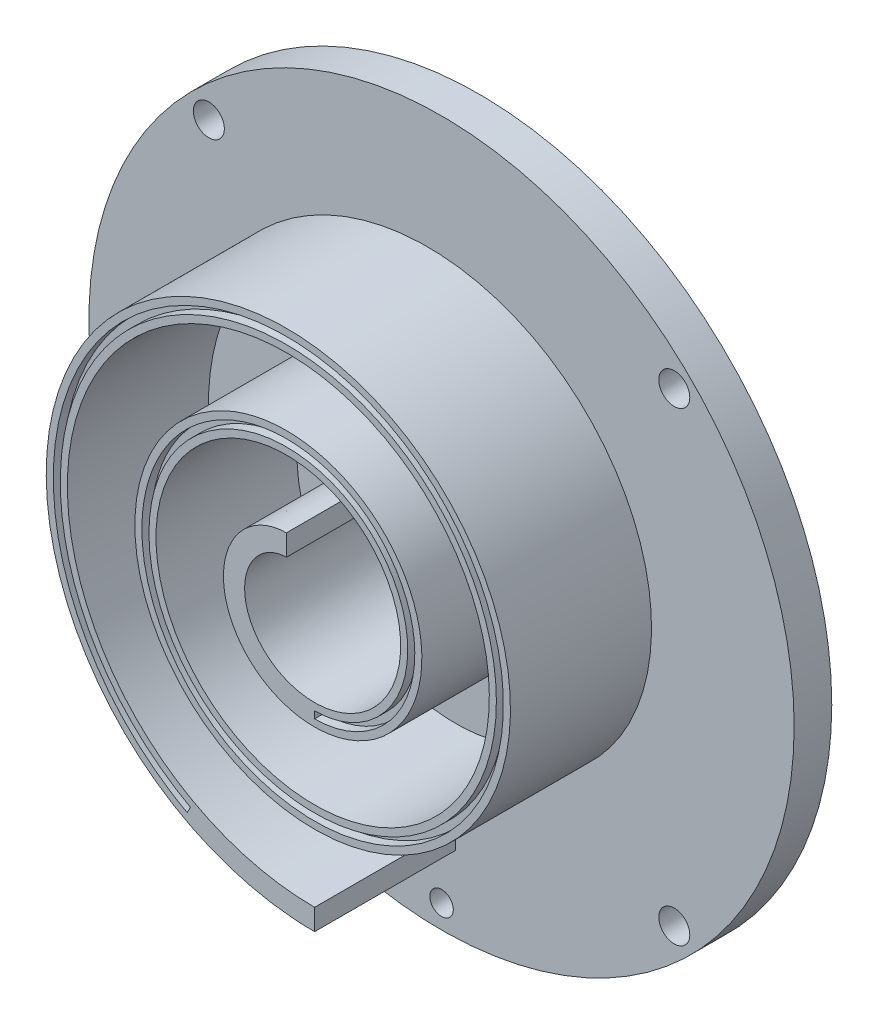
from build123d import *

# Parameters (mm, degrees)
SKETCH_1_R          = 75
EXTRUDE_1_DEPTH     = 8
SKETCH_2_R          = 5
CUT_EXTRUDE_1_DEPTH = 107.367288205
EXTRUDE_2_DEPTH     = 30
SKETCH_4_R          = 3.3
CUT_EXTRUDE_2_DEPTH = 113.667653023
SKETCH_5_R          = 2.5
CUT_EXTRUDE_3_DEPTH = 113.667653023
CUT_EXTRUDE_4_DEPTH = 2


with BuildPart() as part:
    # 草图1 → 凸台-拉伸1 (new body)
    with BuildSketch(Plane.XY):
        Circle(SKETCH_1_R)
    extrude(amount=EXTRUDE_1_DEPTH)

    # 草图2 → 切除-拉伸1 (cut, through all)
    with BuildSketch(Plane.XY):
        Circle(SKETCH_2_R)
    extrude(amount=CUT_EXTRUDE_1_DEPTH, mode=Mode.SUBTRACT)

    # 草图3 → 凸台-拉伸2 (add)
    with BuildSketch(Plane.XY.offset(8)):
        with BuildLine():
            Line((3, -58.798668), (3, -54.298667765))
            add(Edge.make_bspline(
                [(3, -54.298667765), (2.445183278, -54.293758638), (1.336490844, -54.283948711), (-0.323572997, -54.20463871), (-1.977695596, -54.078311219), (-3.624333548, -53.900631454), (-5.2619549, -53.673172227), (-6.889043171, -53.395994134), (-8.504095073, -53.069611611), (-10.105625706, -52.694480691), (-11.692167513, -52.271129694), (-13.262271405, -51.800121469), (-14.814509907, -51.282067121), (-16.347475934, -50.717616715), (-17.859788123, -50.107466936), (-19.35008608, -49.452348857), (-20.817038807, -48.753041677), (-22.259338754, -48.010356605), (-23.675708608, -47.225148391), (-25.064898965, -46.398306871), (-26.425691432, -45.530759998), (-27.756897794, -44.623469581), (-29.057364146, -43.6774343), (-30.325965261, -42.693680551), (-31.56161752, -41.673276324), (-32.763265731, -40.61731228), (-33.929893215, -39.526912999), (-35.060521123, -38.403231348), (-36.154207837, -37.247448932), (-37.21004835, -36.060770567), (-38.227180326, -34.8444303), (-39.204777482, -33.599682159), (-40.142057292, -32.32780602), (-41.038277016, -31.030101679), (-41.892734754, -29.707887987), (-42.704773949, -28.362504736), (-43.473775679, -26.995306132), (-44.199170013, -25.607665331), (-44.880423719, -24.200966668), (-45.517057999, -22.77661233), (-46.108625154, -21.336010744), (-46.654733975, -19.880585787), (-47.155028755, -18.4117668), (-47.609205072, -16.930992791), (-48.016999541, -15.439707836), (-48.378197745, -13.939361248), (-48.692626027, -12.431405523), (-48.960158046, -10.917295118), (-49.180713938, -9.398485926), (-49.354257622, -7.876431897), (-49.480797162, -6.35258497), (-49.560384365, -4.828393469), (-49.593121553, -3.305301243), (-49.579147361, -1.784745507), (-49.518650824, -0.268155917), (-49.411858827, 1.243047016), (-49.259048621, 2.747453568), (-49.060533927, 4.243665292), (-48.816672447, 5.730296622), (-48.527867651, 7.205976755), (-48.194559563, 8.669349796), (-47.817229762, 10.119076751), (-47.396404451, 11.553837704), (-46.932641498, 12.972329951), (-46.426546809, 14.373273317), (-45.87875411, 15.755406704), (-45.289945734, 17.117495213), (-44.660830818, 18.45832406), (-43.992161311, 19.776706044), (-43.284717282, 21.071476361), (-42.539321406, 22.341502933), (-41.756819395, 23.585674703), (-40.93809911, 24.802916508), (-40.084072254, 25.992176985), (-39.195683004, 27.152438149), (-38.273905538, 28.282713183), (-37.319743073, 29.382048876), (-36.334223851, 30.449524078), (-35.318400653, 31.484249649), (-34.27335608, 32.485376187), (-33.200192334, 33.452085183), (-32.10003409, 34.383593336), (-30.97403128, 35.279159937), (-29.823349611, 36.138075103), (-28.64917543, 36.959669425), (-27.452715201, 37.743313627), (-26.23518816, 38.488412957), (-24.997831328, 39.194414871), (-23.741895494, 39.860807002), (-22.468641569, 40.487110071), (-21.179348043, 41.072896752), (-19.875297337, 41.617768775), (-18.55778416, 42.121373358), (-17.228111238, 42.583402637), (-15.887585272, 43.003579155), (-14.537521779, 43.381679167), (-13.179236458, 43.717508688), (-11.814049999, 44.010921774), (-10.443283157, 44.261811249), (-9.068257711, 44.470112271), (-7.690293499, 44.635799608), (-6.310708499, 44.758889069), (-4.930816396, 44.839438718), (-3.551925689, 44.877542296), (-2.175338744, 44.873342066), (-0.802350879, 44.827009275), (0.565751434, 44.738766404), (1.927691793, 44.60886611), (3.282204702, 44.437604682), (4.628037612, 44.225314725), (5.963950119, 43.972366277), (7.288717707, 43.679168099), (8.601130696, 43.346166188), (9.899996556, 42.973840543), (11.18414051, 42.562708643), (12.452407252, 42.113323004), (13.703660309, 41.626268698), (14.936786193, 41.102168297), (16.150689817, 40.541670298), (17.34430286, 39.945462288), (18.516579812, 39.314261523), (19.666498233, 38.64881137), (20.793063612, 37.94988975), (21.89530756, 37.218302636), (22.972286427, 36.454880345), (24.023088326, 35.660485368), (25.046827897, 34.836001912), (26.04265161, 33.982342384), (27.009734166, 33.100439371), (27.947279505, 32.191254668), (28.854538112, 31.255757518), (30.021469267, 29.976204711), (31.401305324, 28.315991692), (32.92665999, 26.232979043), (34.315340086, 24.069821918), (35.563243292, 21.835457772), (36.666891884, 19.538958227), (37.623380812, 17.189571216), (38.430393872, 14.79666044), (39.086203787, 12.369674984), (39.589685854, 9.918112123), (39.940296526, 7.451476554), (40.138091475, 4.979247168), (40.183709482, 2.510839817), (40.078358865, 0.055570125), (39.823826121, -2.377379994), (39.422447135, -4.778998559), (38.87709439, -7.140473606), (38.191177901, -9.453230468), (37.368601652, -11.708956971), (36.41376769, -13.899639521), (35.331539091, -16.017586107), (34.127222375, -18.055455658), (32.806545293, -20.006284226), (31.375622653, -21.863504428), (29.840940968, -23.620973859), (28.209319854, -25.272989587), (26.487884915, -26.814306106), (24.684041302, -28.240156286), (22.805436263, -29.54625956), (20.859932367, -30.728838736), (18.855571379, -31.784627534), (16.800543203, -32.710877893), (14.70315084, -33.505366043), (12.571780743, -34.166399853), (10.414864801, -34.692814867), (8.240849409, -35.083973092), (6.058162794, -35.33977116), (3.87518086, -35.460617293), (1.700196679, -35.447446289), (-0.45861227, -35.301688921), (-2.593213948, -35.025277509), (-4.695752936, -34.620630143), (-6.758576554, -34.0906243), (-8.774267417, -33.438604168), (-10.735664229, -32.668337037), (-12.635891754, -31.784013964), (-14.468383604, -30.79022021), (-16.226902532, -29.691913167), (-17.905564619, -28.494403223), (-19.498856017, -27.20332483), (-21.001652762, -25.82461414), (-22.409235722, -24.364481066), (-23.717306006, -22.829384483), (-24.921994535, -21.226000098), (-26.01987308, -19.561193711), (-27.007970669, -17.841996707), (-27.883764939, -16.075566954), (-28.645206123, -14.269171491), (-29.290703255, -12.430145866), (-29.819133589, -10.565870776), (-30.229843248, -8.683741271), (-30.522638774, -6.791136097), (-30.697789924, -4.895390601), (-30.756015729, -3.003766979), (-30.698483087, -1.123427528), (-30.526793603, 0.738592998), (-30.242972224, 2.575413816), (-29.849459644, 4.380333335), (-29.349088781, 6.146853688), (-28.74507585, 7.868703095), (-28.041003537, 9.539860959), (-27.240797966, 11.154574699), (-26.348713877, 12.707383476), (-25.369308462, 14.193131925), (-24.307427185, 15.606992451), (-23.16817219, 16.944473907), (-21.95688853, 18.201442907), (-20.679131983, 19.374129041), (-19.340650399, 20.459142162), (-17.947351004, 21.453471468), (-16.505285083, 22.354505629), (-15.020613755, 23.16002732), (-13.499586276, 23.86822366), (-11.948511601, 24.477683816), (-10.373735042, 24.987407232), (-8.781609287, 25.39679005), (-7.178472767, 25.705638045), (-5.570620873, 25.914144345), (-3.964283666, 26.022904804), (-2.36560024, 26.032886867), (-0.780595761, 25.945442886), (0.784839878, 25.762282124), (2.324976688, 25.485474282), (3.834263005, 25.117424145), (5.307345837, 24.660860059), (6.739093184, 24.118830258), (8.12460437, 23.494663936), (9.459236886, 22.791980051), (10.738610938, 22.014644858), (11.958632628, 21.166770695), (13.115500084, 20.252686194), (14.20571995, 19.276920125), (15.226110449, 18.244175188), (16.173820378, 17.159314988), (17.046323828, 16.027332195), (17.841436553, 14.853334638), (18.557311555, 13.642517132), (19.192449195, 12.400142536), (19.745692941, 11.131517965), (20.216229519, 9.841971023), (20.603591346, 8.536831196), (20.907648523, 7.221404156), (21.128607196, 5.900952868), (21.267001636, 4.580675874), (21.323690548, 3.265687108), (21.299845327, 1.960994899), (21.196939637, 0.671484529), (21.016744092, -0.598101303), (20.761308049, -1.843178439), (20.432950226, -3.059339656), (20.034245916, -4.242369538), (19.568007081, -5.388257985), (19.037273777, -6.493214762), (18.445290926, -7.553680634), (17.795497522, -8.566339894), (17.091506136, -9.528130707), (16.337083884, -10.436250867), (15.536136195, -11.288168675), (14.69268787, -12.081627149), (13.810861877, -12.814649062), (12.894864117, -13.485541947), (11.94895942, -14.092898112), (10.977458287, -14.635599573), (9.984690869, -15.112810397), (8.974996248, -15.523988191), (7.952695067, -15.868863875), (6.922079524, -16.147458162), (5.887388915, -16.360054746), (4.852796911, -16.507216035), (3.822391984, -16.589756649), (2.800162761, -16.608748939), (1.78998237, -16.565507549), (0.795593681, -16.461577763), (-0.179405327, -16.298731827), (-1.1315734, -16.078947307), (-2.057638908, -15.804402963), (-2.95451031, -15.477460279), (-3.819286562, -15.10065191), (-4.649267055, -14.676666449), (-5.441958956, -14.208334594), (-6.195082957, -13.698609963), (-6.906582995, -13.150561314), (-7.574624745, -12.567345872), (-8.197607822, -11.952205372), (-8.774160424, -11.308439813), (-9.303144483, -10.639396486), (-9.783658558, -9.948454271), (-10.215027793, -9.239001944), (-10.596818196, -8.514432691), (-10.928814418, -7.778117065), (-11.211032545, -7.033396504), (-11.443706443, -6.283564764), (-11.627285208, -5.531854905), (-11.762421449, -4.781424236), (-11.849972076, -4.035342542), (-11.890983973, -3.296579139), (-11.886687086, -2.567991075), (-11.838481464, -1.852312321), (-11.747934724, -1.152142345), (-11.616758854, -0.469938904), (-11.44680876, 0.191992274), (-11.240068093, 0.831504433), (-10.998632776, 1.446619948), (-10.724703638, 2.035521357), (-10.420550009, 2.596605844), (-9.982059301, 3.299010947), (-9.372088363, 4.102648195), (-8.551579671, 4.945499353), (-7.669354304, 5.653415759), (-6.745661706, 6.224044334), (-5.800195882, 6.659194275), (-4.851790838, 6.95912256), (-3.918074998, 7.141273419), (-3.301005261, 7.163792999), (-3, 7.174778)],
                knots=[0, 0, 0, 0, 0.003447685, 0.006889523, 0.010325511, 0.013755651, 0.017179942, 0.020598382, 0.024010975, 0.027417717, 0.030818612, 0.034213659, 0.037602855, 0.040986203, 0.044363701, 0.047735352, 0.051101152, 0.054461103, 0.057815207, 0.061163461, 0.064505865, 0.067842422, 0.071173128, 0.074497986, 0.077816996, 0.081130156, 0.084437468, 0.087738929, 0.091034544, 0.094324307, 0.097608222, 0.10088629, 0.104158507, 0.107424875, 0.110685395, 0.113940066, 0.117188888, 0.12043186, 0.123668984, 0.126900259, 0.130125686, 0.133345263, 0.136558991, 0.13976687, 0.1429689, 0.14616508, 0.149355414, 0.152539897, 0.155718531, 0.158891316, 0.162058252, 0.165219339, 0.168374579, 0.171523969, 0.174667509, 0.177805201, 0.180937043, 0.184063037, 0.187183182, 0.190297479, 0.193405925, 0.196508523, 0.199605273, 0.202696172, 0.205781224, 0.208860425, 0.211933778, 0.215001284, 0.218062939, 0.221118745, 0.224168701, 0.22721281, 0.230251069, 0.233283481, 0.236310042, 0.239330755, 0.242345619, 0.245354632, 0.248357799, 0.251355117, 0.254346584, 0.257332204, 0.260311973, 0.263285894, 0.266253967, 0.269216191, 0.272172563, 0.275123089, 0.278067765, 0.281006593, 0.283939572, 0.2868667, 0.289787982, 0.292703413, 0.295612996, 0.29851673, 0.301414614, 0.30430665, 0.307192837, 0.310073175, 0.312947665, 0.315816305, 0.318679094, 0.321536036, 0.324387129, 0.327232374, 0.33007177, 0.332905315, 0.335733013, 0.338554861, 0.341370862, 0.344181011, 0.346985313, 0.349783765, 0.352576369, 0.355363124, 0.35814403, 0.360919086, 0.363688295, 0.366451653, 0.369209162, 0.371960823, 0.374706635, 0.377446599, 0.380180714, 0.382908979, 0.385631394, 0.388347962, 0.391058681, 0.393763549, 0.396462569, 0.399155742, 0.404523905, 0.409868677, 0.415190057, 0.420488042, 0.425762633, 0.431013832, 0.436241639, 0.441446052, 0.446627072, 0.451784699, 0.456918932, 0.462029775, 0.467117222, 0.472181277, 0.477221939, 0.482239208, 0.487233084, 0.492203566, 0.497150655, 0.502074352, 0.506974654, 0.511851565, 0.516705082, 0.521535207, 0.526341938, 0.531125277, 0.535885222, 0.540621773, 0.545334933, 0.550024698, 0.554691071, 0.559334051, 0.563953639, 0.568549833, 0.573122633, 0.577672041, 0.582198056, 0.586700677, 0.591179906, 0.595635741, 0.600068183, 0.604477232, 0.608862889, 0.613225152, 0.617564022, 0.621879499, 0.626171585, 0.630440276, 0.634685574, 0.638907478, 0.643105991, 0.647281111, 0.651432836, 0.655561168, 0.659666108, 0.663747654, 0.667805809, 0.67184057, 0.675851938, 0.679839913, 0.683804493, 0.687745681, 0.691663477, 0.695557879, 0.699428888, 0.703276505, 0.707100729, 0.710901558, 0.714678996, 0.718433039, 0.722163691, 0.725870949, 0.729554814, 0.733215286, 0.736852365, 0.74046605, 0.744056343, 0.747623242, 0.751166748, 0.754686863, 0.758183583, 0.76165691, 0.765106845, 0.768533385, 0.771936534, 0.77531629, 0.778672652, 0.782005621, 0.785315198, 0.788601379, 0.791864171, 0.795103567, 0.798319571, 0.801512182, 0.8046814, 0.807827225, 0.810949656, 0.814048695, 0.81712434, 0.820176594, 0.823205452, 0.826210919, 0.829192992, 0.832151673, 0.83508696, 0.837998855, 0.840887355, 0.843752465, 0.846594179, 0.8494125, 0.852207429, 0.854978966, 0.857727109, 0.860451859, 0.863153215, 0.86583118, 0.868485751, 0.871116928, 0.873724712, 0.876309103, 0.878870102, 0.881407708, 0.88392192, 0.88641274, 0.888880166, 0.8913242, 0.893744839, 0.896142088, 0.89851594, 0.900866402, 0.903193469, 0.905497146, 0.907777427, 0.910034316, 0.912267812, 0.914477914, 0.916664624, 0.91882794, 0.920967864, 0.923084395, 0.925177533, 0.927247278, 0.929293628, 0.931316587, 0.933316153, 0.935292325, 0.937245105, 0.93917449, 0.941080484, 0.942963083, 0.94482229, 0.946658104, 0.948470525, 0.950259554, 0.952025189, 0.95376743, 0.955486279, 0.957181735, 0.958853797, 0.960502466, 0.962127744, 0.963729628, 0.965308117, 0.966863214, 0.96839492, 0.96990323, 0.971388148, 0.972849674, 0.974287807, 0.975702546, 0.977093892, 0.978461845, 0.979806405, 0.981127572, 0.982425346, 0.984949526, 0.987380178, 0.989717301, 0.991960897, 0.994110966, 0.996167504, 0.998130517, 1, 1, 1, 1], degree=3))
            Line((-3, 7.174778), (-3, 11.674777961))
            add(Edge.make_bspline(
                [(-3, 11.674777961), (-3.240666522, 11.670474975), (-3.725764482, 11.661801689), (-4.456285569, 11.591617542), (-5.192454744, 11.47832924), (-5.931288534, 11.316801958), (-6.66971111, 11.107439414), (-7.404566095, 10.849383043), (-8.132626479, 10.542376743), (-8.850617017, 10.186282877), (-9.555216939, 9.781200262), (-10.243086097, 9.327454779), (-10.910870697, 8.825594305), (-11.555225656, 8.276400839), (-12.17282846, 7.680887402), (-12.7603904, 7.040295157), (-13.314681323, 6.356101036), (-13.832536613, 5.630005617), (-14.310879344, 4.863937858), (-14.746733125, 4.060045726), (-15.137241754, 3.220695732), (-15.479676845, 2.348460582), (-15.771460163, 1.446117229), (-16.010173617, 0.516635118), (-16.193579527, -0.436831771), (-16.319625286, -1.410957617), (-16.386460736, -2.402254334), (-16.392453095, -3.407083677), (-16.336193495, -4.421672648), (-16.216509686, -5.44212543), (-16.032476379, -6.464441064), (-15.783422718, -7.484525975), (-15.468936208, -8.498211471), (-15.088882335, -9.50127333), (-14.643391519, -10.489444361), (-14.132878167, -11.458436594), (-13.558036793, -12.403956519), (-12.919847667, -13.321726192), (-12.219575001, -14.207500612), (-11.458765357, -15.05708494), (-10.63925231, -15.866360066), (-9.763144237, -16.631291327), (-8.832827542, -17.347956481), (-7.850959133, -18.012561923), (-6.820456374, -18.621457434), (-5.744491917, -19.171157298), (-4.626486414, -19.658361336), (-3.470092151, -20.079961959), (-2.279188438, -20.433072508), (-1.057862934, -20.715036668), (0.189600415, -20.923438745), (1.458734255, -21.056131551), (2.744906157, -21.11123461), (4.043334928, -21.087156765), (5.349108192, -20.982604585), (6.657200489, -20.796587306), (7.96249331, -20.528434592), (9.259796401, -20.177799897), (10.543864031, -19.744660202), (11.809421796, -19.229337331), (13.051182905, -18.632484569), (14.263873893, -17.955100037), (15.442255081, -17.198523185), (16.581141718, -16.364434898), (17.675429934, -15.454857106), (18.7201148, -14.472147283), (19.710313856, -13.418992936), (20.641291878, -12.298410489), (21.508478982, -11.113731206), (22.307491468, -9.868594479), (23.034159049, -8.566939723), (23.684533868, -7.212988841), (24.254918029, -5.811237353), (24.74188588, -4.366440801), (25.142285914, -2.88359209), (25.45327733, -1.367912474), (25.672329098, 0.175173238), (25.797246812, 1.740051611), (25.826175779, 3.320943723), (25.757625769, 4.911924322), (25.590468117, 6.506946135), (25.323953104, 8.099861382), (24.957716374, 9.684446165), (24.491788992, 11.254425227), (23.926592515, 12.803494273), (23.262954888, 14.325348693), (22.502100966, 15.813705775), (21.645664146, 17.262335169), (20.695669773, 18.665076687), (19.654551091, 20.015877143), (18.525124093, 21.308802269), (17.310600487, 22.538078308), (16.014560826, 23.698100366), (14.640962337, 24.78347337), (13.1941142, 25.789023863), (11.678670993, 26.709828568), (10.099616357, 27.541237515), (8.462249293, 28.278897798), (6.772160724, 28.918764204), (5.0352234, 29.457138411), (3.257562572, 29.890665363), (1.445541614, 30.216372013), (-0.394265823, 30.431662495), (-2.255095363, 30.534355047), (-4.130020347, 30.522676756), (-6.011975311, 30.395288577), (-7.893783424, 30.151281828), (-9.768184142, 29.790207036), (-11.627859738, 29.312056129), (-13.465467655, 28.717293091), (-15.273662923, 28.006831477), (-17.04513463, 27.182059333), (-18.77263055, 26.244824331), (-20.448986113, 25.197433113), (-22.067159868, 24.042655656), (-23.620254973, 22.783708332), (-25.101554324, 21.424253354), (-26.50454521, 19.968386091), (-27.822948958, 18.420624106), (-29.050750458, 16.785895463), (-30.182217345, 15.069518493), (-31.211935122, 13.277191246), (-32.13482769, 11.414969863), (-32.946179176, 9.489247274), (-33.641658384, 7.506733276), (-34.217340793, 5.474430887), (-34.669724187, 3.399610566), (-34.995755121, 1.289787194), (-35.192833031, -0.847310827), (-35.258840866, -3.00376665), (-35.192139705, -5.171506949), (-34.9916007, -7.342330068), (-34.656593931, -9.507937937), (-34.18701355, -11.65996817), (-33.583272919, -13.790025888), (-32.84630975, -15.889716119), (-31.977589056, -17.95067636), (-30.979106595, -19.964612965), (-29.853375738, -21.923328855), (-28.603435001, -23.818763318), (-27.232828579, -25.643017361), (-25.745608211, -27.388393127), (-24.146319011, -29.047424734), (-22.439978298, -30.612902977), (-20.632074426, -32.077916772), (-18.728537915, -33.435874943), (-16.735728506, -34.680537627), (-14.66041309, -35.806045766), (-12.50974169, -36.806945801), (-10.291223256, -37.678210823), (-8.012702526, -38.415276178), (-5.682327373, -39.014044123), (-3.308524808, -39.470924245), (-0.899966031, -39.782830279), (1.534460534, -39.94722032), (3.98568607, -39.962085986), (6.444493231, -39.825992572), (8.901550865, -39.538060906), (11.34745112, -39.098006303), (13.772741499, -38.506114199), (16.167966253, -37.76327032), (18.523698816, -36.870943919), (20.830583633, -35.831201319), (23.079366189, -34.64668758), (25.260939157, -33.320637483), (27.366369456, -31.856860964), (29.386951067, -30.259713946), (31.314179994, -28.53417107), (32.834104822, -26.995260991), (33.995364601, -25.706033368), (34.839058849, -24.70952543), (35.653538394, -23.68540606), (36.437911501, -22.634519062), (37.191297492, -21.557752702), (37.912848145, -20.456021221), (38.601736276, -19.330264885), (39.257169088, -18.181454588), (39.878376449, -17.010584489), (40.46462131, -15.818675866), (41.015197971, -14.606774447), (41.529429006, -13.375948694), (42.006670405, -12.127289726), (42.446312633, -10.861912382), (42.847777467, -9.580949415), (43.210519314, -8.285554405), (43.534036274, -6.976901287), (43.817847784, -5.656178545), (44.061523172, -4.324593905), (44.264660731, -2.983368981), (44.426897602, -1.633740068), (44.54791087, -0.276956926), (44.627410118, 1.085719487), (44.665152296, 2.453015949), (44.660924525, 3.823650673), (44.614561549, 5.196333071), (44.52592955, 6.569765701), (44.394943144, 7.942644529), (44.221550156, 9.313660978), (44.005744516, 10.681503127), (43.747555504, 12.044856623), (43.447057526, 13.40240578), (43.104363526, 14.752835841), (42.719628492, 16.094832909), (42.293047507, 17.427086468), (41.824858984, 18.748289939), (41.315337225, 20.057141391), (40.764801647, 21.352346257), (40.173611952, 22.632618381), (39.542165748, 23.896679448), (38.870902832, 25.143262759), (38.160303111, 26.371112947), (37.410884801, 27.578987356), (36.623206625, 28.765658252), (35.797864245, 29.929912795), (34.935493253, 31.070554345), (34.036769752, 32.186406964), (33.10240023, 33.276308112), (32.13313704, 34.339123477), (31.129761433, 35.373733577), (30.093093717, 36.379043614), (29.023989816, 37.353984298), (27.923339287, 38.297509994), (26.79206469, 39.208601044), (25.631121523, 40.086263613), (24.441500194, 40.92953689), (23.224216841, 41.73748088), (21.980323926, 42.509195083), (20.710899768, 43.243804774), (19.417052507, 43.940468062), (18.099917753, 44.598376682), (16.760657693, 45.216756546), (15.400459729, 45.7948685), (14.02053736, 46.332011045), (12.622125056, 46.827512534), (11.206482173, 47.280746971), (9.774888496, 47.691122966), (8.328641844, 48.058083759), (6.869063127, 48.381121974), (5.397486593, 48.659759233), (3.91526624, 48.89356556), (2.423769591, 49.082149981), (0.924378846, 49.225162034), (-0.581511283, 49.322294808), (-2.092494786, 49.373284318), (-3.607155686, 49.377909769), (-5.124068626, 49.335992555), (-6.641801284, 49.247400277), (-8.158914732, 49.112043059), (-9.673965969, 48.92987347), (-11.185508795, 48.700894744), (-12.692094221, 48.425148445), (-14.192272979, 48.102723093), (-15.684597187, 47.733756025), (-17.167620331, 47.318422073), (-18.639900434, 46.856949863), (-20.099999393, 46.349603852), (-21.546486565, 45.796701082), (-22.977938708, 45.19859872), (-24.392941786, 44.555700731), (-25.790092445, 43.868454168), (-27.167998815, 43.137349812), (-28.52528296, 42.362922193), (-29.860582238, 41.54575156), (-31.172548609, 40.686456926), (-32.459853105, 39.785704312), (-33.721184007, 38.844197693), (-34.955252323, 37.862686625), (-36.160786422, 36.84195649), (-37.336541566, 35.782837617), (-38.481293754, 34.686197451), (-39.593846308, 33.552943062), (-40.67302916, 32.384019978), (-41.717698476, 31.180410128), (-42.72674119, 29.943133615), (-43.699071968, 28.67324441), (-44.633639962, 27.371833506), (-45.529422517, 26.040022955), (-46.385434055, 24.678970946), (-47.200724243, 23.289866958), (-47.974372287, 21.873928602), (-48.705501955, 20.432407242), (-49.393265664, 18.966579073), (-50.036865078, 17.477752453), (-50.635532525, 15.967258841), (-51.188542341, 14.436455638), (-51.695213297, 12.886725605), (-52.15490373, 11.319472854), (-52.567013431, 9.736123429), (-52.930985802, 8.138123828), (-53.246313981, 6.526940691), (-53.512525665, 4.904055859), (-53.729204079, 3.270969632), (-53.895969357, 1.629195389), (-54.012495364, -0.019738724), (-54.078498598, -1.674293185), (-54.093742061, -3.332917236), (-54.058041109, -4.994051756), (-53.971255602, -6.656129822), (-53.833290995, -8.317578092), (-53.644108011, -9.976818353), (-53.403712626, -11.632269388), (-53.112155687, -13.282347694), (-52.769546713, -14.925471308), (-52.376033478, -16.560057811), (-51.931820016, -18.184528203), (-51.437157395, -19.797307994), (-50.892346787, -21.396828633), (-50.297733421, -22.98152775), (-49.65371852, -24.549854443), (-48.960745024, -26.100266013), (-48.219309597, -27.631233319), (-47.429950938, -29.141239049), (-46.593262314, -30.628782975), (-45.709875216, -32.092378115), (-44.7804781, -33.530560058), (-43.805796004, -34.94187913), (-42.786605483, -36.324909452), (-41.723726567, -37.678246764), (-40.618022868, -39.000510051), (-39.470402531, -40.29034371), (-38.281814759, -41.546417556), (-37.053255735, -42.767433687), (-35.785754466, -43.952114907), (-34.48039039, -45.099224829), (-33.138274841, -46.207550095), (-31.760561458, -47.275915216), (-30.348441839, -48.303179229), (-28.90314069, -49.288231974), (-27.425923557, -50.230007536), (-25.918084432, -51.127468104), (-24.380956219, -51.979624306), (-22.815901623, -52.785521968), (-21.224312926, -53.544247219), (-19.607614199, -54.254929986), (-17.967257478, -54.916743876), (-16.304721417, -55.52890275), (-14.621511503, -56.090671901), (-12.919156155, -56.601354812), (-11.199207925, -57.060305538), (-9.463241735, -57.466927566), (-7.712851259, -57.820661267), (-5.949650082, -58.121031715), (-4.175267711, -58.367486226), (-2.391350558, -58.55998079), (-0.599559513, -58.696823613), (1.19843255, -58.782725443), (2.399163725, -58.793351037), (3, -58.798668)],
                knots=[0, 0, 0, 0, 0.001304361, 0.002629128, 0.0039743, 0.005339877, 0.006725859, 0.008132247, 0.009559039, 0.011006237, 0.012473841, 0.013961849, 0.015470261, 0.016999079, 0.018548303, 0.020117932, 0.021707967, 0.023318405, 0.024949251, 0.026600499, 0.028272153, 0.029964214, 0.03167668, 0.033409549, 0.035162824, 0.036936504, 0.03873059, 0.040545082, 0.042379976, 0.044235278, 0.046110984, 0.048007097, 0.049923613, 0.051860534, 0.053817861, 0.055795593, 0.057793731, 0.059812273, 0.061851221, 0.063910574, 0.065990331, 0.068090496, 0.070211064, 0.072352037, 0.074513416, 0.076695198, 0.078897389, 0.081119983, 0.083362982, 0.085626386, 0.087910196, 0.090214411, 0.092539031, 0.094884055, 0.097249487, 0.099635322, 0.102041562, 0.104468207, 0.10691526, 0.109382715, 0.111870576, 0.114378843, 0.116907514, 0.119456592, 0.122026073, 0.124615961, 0.127226253, 0.129856951, 0.132508054, 0.135179561, 0.137871474, 0.140583793, 0.143316516, 0.146069645, 0.148843178, 0.151637117, 0.15445146, 0.15728621, 0.160141364, 0.163016925, 0.165912889, 0.168829258, 0.171766034, 0.174723214, 0.1777008, 0.180698791, 0.183717185, 0.186755986, 0.189815192, 0.192894804, 0.195994821, 0.199115241, 0.202256068, 0.205417301, 0.208598936, 0.211800979, 0.215023427, 0.218266279, 0.221529537, 0.2248132, 0.228117268, 0.231441741, 0.23478662, 0.238151903, 0.241537591, 0.244943686, 0.248370185, 0.251817089, 0.255284398, 0.258772112, 0.262280233, 0.265808757, 0.269357687, 0.272927024, 0.276516763, 0.280126909, 0.283757459, 0.287408415, 0.291079776, 0.294771543, 0.298483715, 0.302216291, 0.305969273, 0.30974266, 0.313536452, 0.317350648, 0.321185251, 0.325040259, 0.328915671, 0.33281149, 0.336727713, 0.340664341, 0.344621375, 0.348598813, 0.352596657, 0.356614905, 0.360653561, 0.364712619, 0.368792084, 0.372891954, 0.377012228, 0.381152908, 0.385313994, 0.389495482, 0.393697379, 0.397919679, 0.402162385, 0.406425496, 0.410709011, 0.415012934, 0.41933726, 0.423681991, 0.428047128, 0.43243267, 0.436838618, 0.44126497, 0.445711727, 0.450178889, 0.454666457, 0.459174431, 0.463702809, 0.468251592, 0.472820781, 0.477410374, 0.482020372, 0.486650776, 0.491301585, 0.495972801, 0.50066442, 0.503018158, 0.505376999, 0.507740942, 0.510109986, 0.512484131, 0.514863379, 0.517247729, 0.519637181, 0.522031736, 0.524431391, 0.526836148, 0.529246009, 0.531660969, 0.534081033, 0.536506197, 0.538936465, 0.541371834, 0.543812304, 0.546257876, 0.548708552, 0.551164327, 0.553625205, 0.556091186, 0.558562269, 0.561038452, 0.563519738, 0.566006126, 0.568497616, 0.570994207, 0.573495901, 0.576002696, 0.578514594, 0.581031592, 0.583553694, 0.586080897, 0.588613202, 0.591150608, 0.593693118, 0.596240728, 0.59879344, 0.601351255, 0.603914171, 0.606482188, 0.609055308, 0.61163353, 0.614216855, 0.61680528, 0.619398807, 0.621997436, 0.624601168, 0.627210002, 0.629823936, 0.632442974, 0.635067112, 0.637696353, 0.640330696, 0.64297014, 0.645614686, 0.648264335, 0.650919086, 0.653578937, 0.656243891, 0.658913947, 0.661589106, 0.664269366, 0.666954726, 0.669645191, 0.672340755, 0.675041424, 0.677747191, 0.680458063, 0.683174036, 0.685895111, 0.688621287, 0.691352565, 0.694088946, 0.69683043, 0.699577013, 0.7023287, 0.705085487, 0.707847378, 0.71061437, 0.713386463, 0.716163659, 0.718945956, 0.721733356, 0.724525856, 0.727323461, 0.730126166, 0.732933973, 0.735746882, 0.738564892, 0.741388004, 0.74421622, 0.747049536, 0.749887955, 0.752731475, 0.755580096, 0.758433821, 0.761292647, 0.764156576, 0.767025604, 0.769899735, 0.77277897, 0.775663304, 0.778552741, 0.781447281, 0.784346922, 0.787251666, 0.79016151, 0.793076457, 0.795996506, 0.798921657, 0.801851908, 0.804787264, 0.80772772, 0.810673276, 0.813623937, 0.8165797, 0.819540563, 0.822506529, 0.825477597, 0.828453766, 0.831435037, 0.834421411, 0.837412886, 0.840409463, 0.843411141, 0.846417922, 0.849429805, 0.85244679, 0.855468876, 0.858496064, 0.861528354, 0.864565746, 0.867608242, 0.870655838, 0.873708535, 0.876766335, 0.879829236, 0.882897239, 0.885970345, 0.889048551, 0.892131862, 0.895220272, 0.898313785, 0.9014124, 0.904516117, 0.907624937, 0.910738857, 0.91385788, 0.916982003, 0.920111229, 0.923245558, 0.926384987, 0.92952952, 0.932679153, 0.935833888, 0.938993726, 0.942158666, 0.945328708, 0.948503851, 0.951684096, 0.954869442, 0.958059893, 0.961255443, 0.964456095, 0.967661849, 0.970872707, 0.974088665, 0.977309726, 0.980535888, 0.983767151, 0.987003517, 0.990244986, 0.993491556, 0.996743227, 1, 1, 1, 1], degree=3))
        make_face()
    extrude(amount=EXTRUDE_2_DEPTH)

    # 草图4 → 切除-拉伸2 (cut, through all)
    with BuildSketch(Plane.XY):
        with Locations((49.497475, 49.497475)):
            Circle(SKETCH_4_R)
        with Locations((-49.497475, 49.497475)):
            Circle(SKETCH_4_R)
        with Locations((-49.497475, -49.497475)):
            Circle(SKETCH_4_R)
        with Locations((49.497475, -49.497475)):
            Circle(SKETCH_4_R)
    extrude(amount=CUT_EXTRUDE_2_DEPTH, mode=Mode.SUBTRACT)

    # 草图5 → 切除-拉伸3 (cut, through all)
    with BuildSketch(Plane.XY):
        with Locations((0, -70)):
            Circle(SKETCH_5_R)
    extrude(amount=CUT_EXTRUDE_3_DEPTH, mode=Mode.SUBTRACT)

    # 草图6 → 切除-拉伸4 (cut)
    with BuildSketch(Plane.XY.offset(38)):
        with BuildLine():
            Line((-24.118559, -50.406214), (-23.399502, -49.089858))
            add(Edge.make_bspline(
                [(-23.399502, -49.089858), (-24.14162098, -48.671217592), (-25.623941545, -47.835018408), (-27.766634588, -46.451564712), (-29.840735213, -44.979910366), (-31.836775866, -43.41431295), (-33.752098491, -41.76128736), (-35.582489865, -40.024303276), (-37.32441489, -38.207854932), (-38.974431711, -36.316364307), (-40.529355934, -34.35445853), (-41.986225047, -32.326882659), (-43.342311318, -30.238506205), (-44.595131915, -28.094311482), (-45.742444549, -25.899377406), (-46.782259371, -23.658871244), (-47.712834081, -21.378033082), (-48.532685954, -19.062167431), (-49.240585803, -16.716627343), (-49.835558681, -14.34680362), (-50.316899134, -11.958114717), (-50.684148328, -9.555989688), (-50.937114327, -7.145859283), (-51.075858725, -4.733142669), (-51.100701753, -2.323234552), (-51.012213558, 0.078505347), (-50.811223034, 2.466765358), (-50.498798635, 4.836293366), (-50.076260289, 7.181908053), (-49.545162415, 9.498511168), (-48.907297855, 11.781096659), (-48.1646884, 14.024764145), (-47.319580699, 16.224726952), (-46.37443743, 18.376324103), (-45.331933587, 20.475028829), (-44.194947538, 22.516459253), (-42.966552712, 24.496385652), (-41.650014165, 26.410743492), (-40.248769673, 28.255633636), (-38.766435318, 30.027340293), (-37.206783968, 31.722330257), (-35.573743861, 33.337265242), (-33.871382177, 34.869003481), (-32.103901207, 36.314609972), (-30.275624563, 37.67136022), (-28.390987887, 38.936745326), (-26.454527493, 40.10847571), (-24.470869611, 41.184486107), (-22.444720569, 42.162939709), (-20.380852934, 43.042227209), (-18.284098091, 43.820974448), (-16.159332262, 44.498040997), (-14.011465705, 45.072521709), (-11.845430725, 45.543744802), (-9.666172975, 45.911280626), (-7.478637301, 46.174931177), (-5.287758284, 46.334734777), (-3.098447358, 46.390961651), (-0.915584045, 46.344116682), (1.255997086, 46.194931896), (3.411514602, 45.944363974), (5.546254109, 45.593594752), (7.655575153, 45.144022796), (9.734923746, 44.597260366), (11.779841029, 43.955132608), (13.785972174, 43.219660239), (15.749078939, 42.393072673), (17.665042815, 41.477779323), (19.529880325, 40.476383863), (21.33974581, 39.391662388), (23.090942193, 38.226563594), (24.779927676, 36.984198499), (26.403323445, 35.66783351), (27.957917937, 34.28087852), (29.440677554, 32.826884864), (30.848747949, 31.309529708), (32.179462764, 29.732611787), (33.430345413, 28.10003827), (34.599116203, 26.415817184), (35.683695853, 24.684048431), (36.682207363, 22.908911465), (37.592980178, 21.094658007), (38.414552015, 19.245598807), (39.145674901, 17.366097455), (39.785307224, 15.460554957), (40.332623714, 13.533404309), (40.787016548, 11.589098709), (41.148084201, 9.632098792), (41.415645302, 7.666865954), (41.589727292, 5.697849885), (41.670566769, 3.729479511), (41.658616389, 1.766153192), (41.554526791, -0.187771968), (41.359158544, -2.12798984), (41.073570515, -4.050253379), (40.699019601, -5.950385669), (40.236951256, -7.82428632), (39.689003143, -9.667944483), (39.056996061, -11.477443562), (38.342926155, -13.248972102), (37.548960651, -14.978828735), (36.67743588, -16.663434783), (35.730843249, -18.299335286), (34.71183242, -19.883212782), (33.623193841, -21.411888671), (32.467856585, -22.88233107), (31.248880814, -24.291661711), (29.969450541, -25.637162512), (28.632862839, -26.916277637), (27.242518886, -28.126617859), (25.801922332, -29.265971349), (24.314659871, -30.332297231), (22.784403223, -31.323740119), (21.214892387, -32.23862442), (19.609929532, -33.075459295), (17.97337059, -33.832944502), (16.309114351, -34.50996632), (14.621094543, -35.105604262), (12.913269646, -35.619128003), (11.189612994, -36.049995343), (9.454106868, -36.397864476), (7.710728723, -36.662572653), (5.963445774, -36.844156078), (4.2162039, -36.942835843), (2.472919496, -36.959020176), (0.737470479, -36.893301358), (-0.986311448, -36.746451889), (-2.694651614, -36.519425813), (-4.383837519, -36.213349136), (-6.050229836, -35.829519866), (-7.690267422, -35.369403179), (-9.300477726, -34.834625528), (-10.877482098, -34.226971737), (-12.418003311, -33.548376541), (-13.918872077, -32.800922373), (-15.377036235, -31.98683365), (-16.789562038, -31.108465346), (-18.153644143, -30.168302096), (-19.466608851, -29.16894984), (-20.725920657, -28.113127936), (-21.929186136, -27.003663922), (-23.074159205, -25.843484543), (-24.158739915, -24.635604293), (-25.180992384, -23.383130858), (-26.139127683, -22.089239317), (-27.031526007, -20.75718085), (-27.856723909, -19.390261397), (-28.613429412, -17.991843559), (-29.300512867, -16.565331672), (-29.917013182, -15.114166826), (-30.462139941, -13.641818337), (-30.935273486, -12.15177509), (-31.335958072, -10.647535611), (-31.663912622, -9.132603965), (-31.919022757, -7.610477965), (-32.101341267, -6.08464215), (-32.211086888, -4.558560106), (-32.248643697, -3.035666989), (-32.214552891, -1.519360909), (-32.10952136, -0.012995617), (-31.93440829, 1.48012687), (-31.690228286, 2.956763052), (-31.37813922, 4.413735044), (-30.999452047, 5.847938409), (-30.555614305, 7.25634828), (-30.048211932, 8.63602478), (-29.478960352, 9.984120122), (-28.84970328, 11.2978846), (-28.162405599, 12.574671373), (-27.419145574, 13.811941991), (-26.622114741, 15.007272042), (-25.773604169, 16.158354939), (-24.876005193, 17.263006004), (-23.931798838, 18.319168436), (-22.943552162, 19.324915745), (-21.913904665, 20.27845122), (-20.845575871, 21.17812317), (-19.741338158, 22.022408198), (-18.604028264, 22.809932231), (-17.436530388, 23.539464156), (-16.241770435, 24.209915253), (-15.022707774, 24.820341351), (-13.782334258, 25.369953485), (-12.52365712, 25.858100208), (-11.249701483, 26.284287183), (-9.963494736, 26.648160067), (-8.668065859, 26.949517457), (-7.36643373, 27.18830187), (-6.061603451, 27.364598388), (-4.756557156, 27.478641197), (-3.454248533, 27.53080057), (-2.15759493, 27.52158976), (-0.86947255, 27.451655936), (0.407291553, 27.32178313), (1.669925173, 27.132883603), (2.915716992, 26.886000006), (4.142021338, 26.582295054), (5.346265764, 26.223055452), (6.525954663, 25.809678791), (7.678675762, 25.343676519), (8.802104964, 24.826668165), (9.89400752, 24.260369661), (10.952249541, 23.646599838), (11.974793543, 22.987262558), (12.959711298, 22.284353313), (13.905177041, 21.53994166), (14.809481823, 20.756177074), (15.671026434, 19.935273182), (16.488331718, 19.079509033), (17.260038255, 18.191221491), (17.98490242, 17.27279193), (18.661811088, 16.326652833), (19.289767996, 15.355267964), (19.867909647, 14.361139205), (20.395490853, 13.346788159), (20.871901503, 12.314759907), (21.296650472, 11.267608239), (21.669379903, 10.207896411), (21.989848465, 9.138185287), (22.257953215, 8.061033053), (22.473704512, 6.978982955), (22.637238448, 5.89456137), (22.748815182, 4.810270753), (22.808810035, 3.72858402), (22.817720532, 2.651937981), (22.776150033, 1.582729894), (22.684821332, 0.523309783), (22.544563298, -0.524022907), (22.356310084, -1.557025348), (22.121098414, -2.573515795), (21.840060148, -3.571377199), (21.514427962, -4.548564558), (21.145517233, -5.503104928), (20.73473835, -6.433106248), (20.283571943, -7.336754322), (19.793587957, -8.212324845), (19.266420003, -9.058178387), (18.703773934, -9.872769551), (18.107413456, -10.654643925), (17.47916628, -11.402448665), (16.820907139, -12.114925293), (16.134558299, -12.790916372), (15.422087982, -13.429370873), (14.685495832, -14.029336796), (13.926815571, -14.589969096), (13.148105415, -15.110527892), (12.35144292, -15.590376599), (11.538924539, -16.028992616), (10.712651231, -16.425950485), (9.87473144, -16.780936181), (9.027270504, -17.093739654), (8.172369156, -17.364252552), (7.312115416, -17.592491246), (6.448580988, -17.778480521), (5.583817016, -17.922700951), (4.719845969, -18.024429888), (3.858662353, -18.087818586), (3.285480209, -18.095653652), (3, -18.099556)],
                knots=[0, 0, 0, 0, 0.005851605, 0.011688092, 0.017509322, 0.023315291, 0.029106003, 0.034881455, 0.040641649, 0.046386584, 0.052116259, 0.057830676, 0.063529836, 0.069213735, 0.074882377, 0.080535759, 0.086173881, 0.091796746, 0.097404352, 0.102996699, 0.108573787, 0.114135618, 0.119682187, 0.125213499, 0.130729551, 0.136230346, 0.141715883, 0.147186157, 0.152641177, 0.158080935, 0.163505436, 0.168914677, 0.17430866, 0.179687383, 0.185050849, 0.190399056, 0.195732003, 0.201049692, 0.206352122, 0.211639293, 0.216911205, 0.222167859, 0.227409253, 0.232635389, 0.237846267, 0.243041885, 0.248222245, 0.253387345, 0.258537187, 0.263671771, 0.268791096, 0.273895161, 0.278983968, 0.284057516, 0.289115806, 0.294158836, 0.299186608, 0.304199119, 0.309196375, 0.31417837, 0.319145107, 0.324096583, 0.329032804, 0.333953763, 0.338859466, 0.343749907, 0.348625092, 0.353485016, 0.358329681, 0.36315909, 0.367973239, 0.372772128, 0.37755576, 0.382324131, 0.387077245, 0.3918151, 0.396537696, 0.401245033, 0.40593711, 0.410613931, 0.415275491, 0.419921794, 0.424552835, 0.42916862, 0.433769146, 0.438354412, 0.442924421, 0.44747917, 0.45201866, 0.456542892, 0.461051866, 0.465545579, 0.470024034, 0.474487229, 0.478935169, 0.483367847, 0.487785268, 0.492187427, 0.496574332, 0.500945973, 0.505302358, 0.509643484, 0.513969352, 0.518279962, 0.522575311, 0.526855403, 0.531120235, 0.535369806, 0.539604122, 0.543823178, 0.548026974, 0.552215512, 0.556388792, 0.560546813, 0.564689575, 0.568817078, 0.572929323, 0.577026307, 0.581108034, 0.585174501, 0.589225711, 0.593261662, 0.597282352, 0.601287785, 0.60527796, 0.609252875, 0.613212532, 0.617156928, 0.621086068, 0.624999946, 0.628898569, 0.632781929, 0.636650034, 0.64050288, 0.644340466, 0.648162791, 0.651969861, 0.65576167, 0.65953822, 0.663299513, 0.667045547, 0.670776321, 0.674491836, 0.678192094, 0.681877092, 0.685546832, 0.689201311, 0.692840532, 0.696464497, 0.700073201, 0.703666644, 0.707244832, 0.71080776, 0.714355429, 0.717887839, 0.721404989, 0.724906883, 0.728393517, 0.731864891, 0.735321007, 0.738761865, 0.742187464, 0.745597803, 0.748992886, 0.752372706, 0.755737271, 0.759086575, 0.76242062, 0.765739409, 0.769042935, 0.772331206, 0.775604215, 0.778861969, 0.78210446, 0.785331695, 0.788543671, 0.791740388, 0.794921845, 0.798088045, 0.801238984, 0.804374667, 0.807495089, 0.810600254, 0.81369016, 0.816764807, 0.819824192, 0.822868323, 0.825897191, 0.828910804, 0.831909155, 0.834892249, 0.837860084, 0.840812661, 0.843749978, 0.846672035, 0.849578837, 0.852470378, 0.855346659, 0.858207682, 0.861053446, 0.863883952, 0.8666992, 0.869499187, 0.872283918, 0.875053388, 0.8778076, 0.880546552, 0.883270247, 0.885978682, 0.88867186, 0.891349776, 0.894012436, 0.896659836, 0.899291979, 0.90190886, 0.904510483, 0.907096849, 0.909667956, 0.912223804, 0.914764392, 0.917289723, 0.919799794, 0.922294605, 0.92477416, 0.927238453, 0.92968749, 0.932121267, 0.934539785, 0.936943046, 0.939331047, 0.941703789, 0.944061272, 0.946403495, 0.948730462, 0.951042168, 0.953338617, 0.955619807, 0.957885736, 0.960136408, 0.962371822, 0.964591975, 0.96679687, 0.968986507, 0.971160883, 0.973320003, 0.975463863, 0.977592464, 0.979705808, 0.981803892, 0.983886716, 0.985954282, 0.98800659, 0.990043639, 0.992065427, 0.994071959, 0.996063231, 0.998039245, 1, 1, 1, 1], degree=3))
            Line((3, -18.099556), (3, -19.599556))
            add(Edge.make_bspline(
                [(3, -19.599556), (3.309047261, -19.595332849), (3.929363504, -19.586856188), (4.861091565, -19.51828353), (5.795292902, -19.408288737), (6.729818493, -19.252444023), (7.662488879, -19.051569308), (8.591100119, -18.805199272), (9.513429546, -18.513358698), (10.427238193, -18.176071417), (11.330278703, -17.793503977), (12.22030071, -17.365926035), (13.095055576, -16.893723126), (13.952299706, -16.377386962), (14.789808199, -15.817532075), (15.605368651, -15.214874182), (16.396798303, -14.570250742), (17.161941174, -13.884604213), (17.89867908, -13.158990465), (18.604934734, -12.39457312), (19.27867834, -11.592624627), (19.917931195, -10.754521301), (20.520775693, -9.881744568), (21.085353734, -8.975874865), (21.609879531, -8.038592903), (22.092639534, -7.071673521), (22.53199893, -6.076983372), (22.926408397, -5.05647872), (23.274404315, -4.012199403), (23.574619435, -2.946266621), (23.825780104, -1.860877084), (24.026718007, -0.758300376), (24.176368756, 0.359126751), (24.273775547, 1.489006208), (24.318097073, 2.628881704), (24.308610467, 3.776246338), (24.24470103, 4.928545979), (24.125892446, 6.08318699), (23.951814962, 7.237539477), (23.722241595, 8.388946562), (23.437060494, 9.534727069), (23.09629959, 10.672185255), (22.700111538, 11.798613767), (22.248783881, 12.911302239), (21.742737039, 14.007542302), (21.182526152, 15.084637119), (20.568835599, 16.139902573), (19.902487856, 17.17068108), (19.184435212, 18.174341229), (18.415758431, 19.148285989), (17.59767708, 20.089966788), (16.73152878, 20.996875785), (15.818787419, 21.866568607), (14.861042831, 22.696654337), (13.860015734, 23.484820161), (12.817535713, 24.228814782), (11.735558028, 24.926481048), (10.616142482, 25.575736451), (9.461461602, 26.174598216), (8.273790284, 26.721176522), (7.055504562, 27.213688515), (5.809074935, 27.65045686), (4.537061737, 28.029918091), (3.242111453, 28.350628184), (1.926948527, 28.611263068), (0.594372872, 28.810629945), (-0.752748883, 28.947665249), (-2.111488104, 29.021435507), (-3.478860523, 29.031154334), (-4.851833942, 28.976168436), (-6.22733311, 28.855973541), (-7.602248587, 28.670212476), (-8.973441293, 28.418671523), (-10.337752972, 28.101293889), (-11.692010802, 27.718172903), (-13.033035953, 27.269554072), (-14.357649777, 26.755838283), (-15.662683323, 26.177580966), (-16.944983267, 25.535492837), (-18.201419811, 24.830437157), (-19.428894415, 24.063432289), (-20.624349575, 23.235651373), (-21.784769973, 22.348413052), (-22.907197971, 21.403191285), (-23.988734464, 20.401603973), (-25.02655161, 19.345416168), (-26.017895728, 18.236532872), (-26.960095493, 17.076997862), (-27.850571367, 15.868990917), (-28.686840008, 14.614823267), (-29.466521377, 13.316931254), (-30.187343497, 11.977874277), (-30.847153849, 10.600329323), (-31.443919489, 9.18708492), (-31.975736333, 7.741035188), (-32.440833538, 6.265175363), (-32.83757849, 4.76259501), (-33.16448389, 3.23647158), (-33.420206663, 1.690062728), (-33.603560202, 0.126701123), (-33.713515171, -1.450213779), (-33.749197903, -3.03722306), (-33.709901825, -4.630815993), (-33.595087312, -6.227437049), (-33.404381642, -7.823494819), (-33.137585081, -9.415369558), (-32.794671419, -10.99942217), (-32.375785461, -12.57200012), (-31.881253323, -14.12944955), (-31.311574487, -15.668120518), (-30.667425085, -17.184377758), (-29.949655729, -18.674606464), (-29.15929762, -20.135225333), (-28.297551183, -21.56268967), (-27.365795506, -22.95350577), (-26.365574092, -24.304232015), (-25.298609669, -25.61149872), (-24.16677892, -26.871999538), (-22.972133902, -28.082519166), (-21.716878387, -29.239925584), (-20.403374298, -30.341185653), (-19.034137515, -31.383374133), (-17.611826191, -32.363672625), (-16.139246387, -33.279390421), (-14.619334514, -34.127956526), (-13.055162278, -34.906940738), (-11.449922036, -35.614046705), (-9.806928028, -36.247133058), (-8.12960201, -36.804202927), (-6.421473503, -37.283427283), (-4.686165578, -37.683133415), (-2.927391909, -38.001821234), (-1.148947484, -38.238168711), (0.645300551, -38.391022209), (2.451419266, -38.459421959), (4.265421542, -38.442583869), (6.083272205, -38.339920121), (7.900897818, -38.151028458), (9.714195927, -37.875707511), (11.519044625, -37.513943593), (13.311311369, -37.065927255), (15.086863668, -36.532043679), (16.841575035, -35.912874471), (18.571340965, -35.209207182), (20.272080723, -34.422018709), (21.939753579, -33.552489947), (23.570364134, -32.601993246), (25.159974891, -31.572099309), (26.704713845, -30.464567578), (28.200782605, -29.281346803), (29.644469057, -28.024572836), (31.032153162, -26.696563497), (32.360319451, -25.299815268), (33.62556066, -23.836996744), (34.824592767, -22.310947005), (35.954258517, -20.724667275), (37.011536505, -19.081316217), (37.993549718, -17.384204292), (38.897574192, -15.636787523), (39.72104218, -13.842657425), (40.461555294, -12.005537522), (41.116883602, -10.12927294), (41.684982567, -8.217825403), (42.163983472, -6.275260486), (42.552216085, -4.305743495), (42.848199961, -2.313527228), (43.050655782, -0.302944497), (43.158509103, 1.721601738), (43.170894956, 3.755647927), (43.087153885, 5.794679647), (42.906848777, 7.834142075), (42.629749612, 9.869449661), (42.255853384, 11.895997522), (41.785368748, 13.90916931), (41.218732621, 15.904350801), (40.556598959, 17.876938876), (39.799841502, 19.82235178), (38.949553725, 21.736039846), (38.007056407, 23.613499655), (36.973874128, 25.450275868), (35.851760008, 27.241983351), (34.642671238, 28.984307242), (33.348778773, 30.673020236), (31.972455753, 32.303987379), (30.516283116, 33.873184869), (28.98302901, 35.376693738), (27.37566558, 36.81073267), (25.697340329, 38.17164244), (23.951386537, 39.455913386), (22.141312142, 40.660189063), (20.27078702, 41.781267878), (18.343645149, 42.816124044), (16.363868643, 43.761903945), (14.335584444, 44.615939801), (12.263054295, 45.37575588), (10.150665265, 46.039074758), (8.002921324, 46.603822693), (5.824433379, 47.068139951), (3.619909326, 47.430378053), (1.394143776, 47.689113997), (-0.847991658, 47.843148404), (-3.101559818, 47.891514609), (-5.361568543, 47.833473228), (-7.62298162, 47.668528449), (-9.880730156, 47.396417232), (-12.129724418, 47.017123288), (-14.364864447, 46.530868652), (-16.581051353, 45.938116818), (-18.773201157, 45.239582191), (-20.93625231, 44.436212873), (-23.065183519, 43.529209504), (-25.155018032, 42.520004552), (-27.200841507, 41.410275834), (-29.197809525, 40.201935478), (-31.141162408, 38.897131231), (-33.026231271, 37.498237035), (-34.848457064, 36.007859018), (-36.6033928, 34.428819586), (-38.286719975, 32.764158631), (-39.894259872, 31.017128889), (-41.421977068, 29.191183358), (-42.865996962, 27.289975337), (-44.222613361, 25.317348849), (-45.488292674, 23.27732786), (-46.659693358, 21.174115003), (-47.733660651, 19.012073853), (-48.707249473, 16.795728762), (-49.57771944, 14.529748765), (-50.342553318, 12.218943301), (-50.999452827, 9.868246261), (-51.546356147, 7.482711305), (-51.981435813, 5.067496135), (-52.303107169, 2.627854565), (-52.510031556, 0.169122668), (-52.601123687, -2.303290105), (-52.575555002, -4.783915356), (-52.432753296, -7.267236785), (-52.172405942, -9.747702117), (-51.794472117, -12.219736507), (-51.299165243, -14.677753447), (-50.686970439, -17.11616886), (-49.958641084, -19.529414693), (-49.1151904, -21.911948152), (-48.157900221, -24.258267703), (-47.08831753, -26.562924967), (-45.908244343, -28.820534337), (-44.619749765, -31.025792799), (-43.225149237, -33.173482811), (-41.727016406, -35.258493797), (-40.128166178, -37.275825067), (-38.431660632, -39.22061014), (-36.640787543, -41.088102648), (-34.759098702, -42.873770022), (-32.790239133, -44.573003128), (-30.738553343, -46.182251509), (-28.606779777, -47.69482524), (-26.404654685, -49.116674853), (-24.881236, -49.976003727), (-24.118559, -50.406214)],
                knots=[0, 0, 0, 0, 0.002038163, 0.004090978, 0.006158446, 0.008240563, 0.010337333, 0.012448754, 0.014574828, 0.016715551, 0.018870928, 0.021040956, 0.023225637, 0.025424968, 0.027638951, 0.029867586, 0.032110874, 0.03436881, 0.0366414, 0.038928643, 0.041230536, 0.04354708, 0.045878276, 0.048224125, 0.050584624, 0.052959775, 0.055349579, 0.057754033, 0.060173139, 0.062606897, 0.065055307, 0.067518369, 0.069996083, 0.072488446, 0.074995463, 0.077517131, 0.08005345, 0.082604422, 0.085170045, 0.08775032, 0.090345246, 0.092954824, 0.095579054, 0.098217935, 0.100871469, 0.103539651, 0.106222489, 0.108919976, 0.111632117, 0.114358907, 0.117100351, 0.119856445, 0.122627191, 0.125412589, 0.128212639, 0.13102734, 0.133856692, 0.136700698, 0.139559353, 0.142432662, 0.145320621, 0.148223233, 0.151140495, 0.154072411, 0.157018975, 0.159980194, 0.162956064, 0.165946585, 0.168951758, 0.171971582, 0.175006059, 0.178055186, 0.181118966, 0.184197396, 0.187290479, 0.190398213, 0.193520601, 0.196657637, 0.199809328, 0.202975669, 0.206156661, 0.209352305, 0.212562602, 0.21578755, 0.21902715, 0.2222814, 0.225550303, 0.228833858, 0.232132063, 0.235444922, 0.23877243, 0.242114592, 0.245471404, 0.248842868, 0.252228983, 0.255629752, 0.259045172, 0.262475242, 0.265919965, 0.26937934, 0.272853365, 0.276342043, 0.279845372, 0.283363354, 0.286895986, 0.29044327, 0.294005206, 0.297581795, 0.301173033, 0.304778925, 0.308399467, 0.312034662, 0.315684508, 0.319349005, 0.323028154, 0.326721955, 0.330430408, 0.334153513, 0.337891269, 0.341643675, 0.345410734, 0.349192446, 0.352988808, 0.356799823, 0.360625488, 0.364465805, 0.368320775, 0.372190395, 0.376074667, 0.379973593, 0.383887167, 0.387815394, 0.391758276, 0.395715806, 0.399687988, 0.403674821, 0.407676308, 0.411692446, 0.415723235, 0.419768674, 0.423828769, 0.427903511, 0.431992908, 0.436096956, 0.440215654, 0.444349006, 0.448497007, 0.452659661, 0.456836966, 0.461028925, 0.465235534, 0.469456796, 0.473692707, 0.477943272, 0.482208486, 0.486488353, 0.490782874, 0.495092044, 0.499415866, 0.50375434, 0.508107465, 0.512475243, 0.516857672, 0.521254752, 0.525666485, 0.530092869, 0.534533904, 0.538989591, 0.543459931, 0.547944921, 0.552444563, 0.556958857, 0.561487802, 0.566031401, 0.57058965, 0.575162549, 0.579750102, 0.584352305, 0.588969162, 0.593600669, 0.598246828, 0.602907639, 0.607583101, 0.612273215, 0.61697798, 0.621697397, 0.626431465, 0.631180187, 0.635943559, 0.640721583, 0.645514258, 0.650321585, 0.655143564, 0.659980195, 0.664831477, 0.669697411, 0.674577997, 0.679473233, 0.684383122, 0.689307662, 0.694246854, 0.699200699, 0.704169193, 0.709152341, 0.714150139, 0.719162589, 0.724189692, 0.729231446, 0.734287851, 0.739358909, 0.744444617, 0.749544978, 0.75465999, 0.759789654, 0.764933968, 0.770092937, 0.775266555, 0.780454825, 0.785657746, 0.79087532, 0.796107546, 0.801354421, 0.806615951, 0.811892132, 0.817182963, 0.822488446, 0.827808582, 0.833143369, 0.838492808, 0.843856898, 0.849235641, 0.854629034, 0.860037079, 0.865459776, 0.870897126, 0.876349125, 0.881815776, 0.887297081, 0.892793036, 0.898303642, 0.903828901, 0.90936881, 0.914923373, 0.920492587, 0.926076453, 0.931674969, 0.937288137, 0.942915958, 0.948558429, 0.954215554, 0.959887328, 0.965573755, 0.971274833, 0.976990563, 0.982720945, 0.988465979, 0.994225663, 1, 1, 1, 1], degree=3))
        make_face()
    extrude(amount=-CUT_EXTRUDE_4_DEPTH, mode=Mode.SUBTRACT)


solid = part.part
